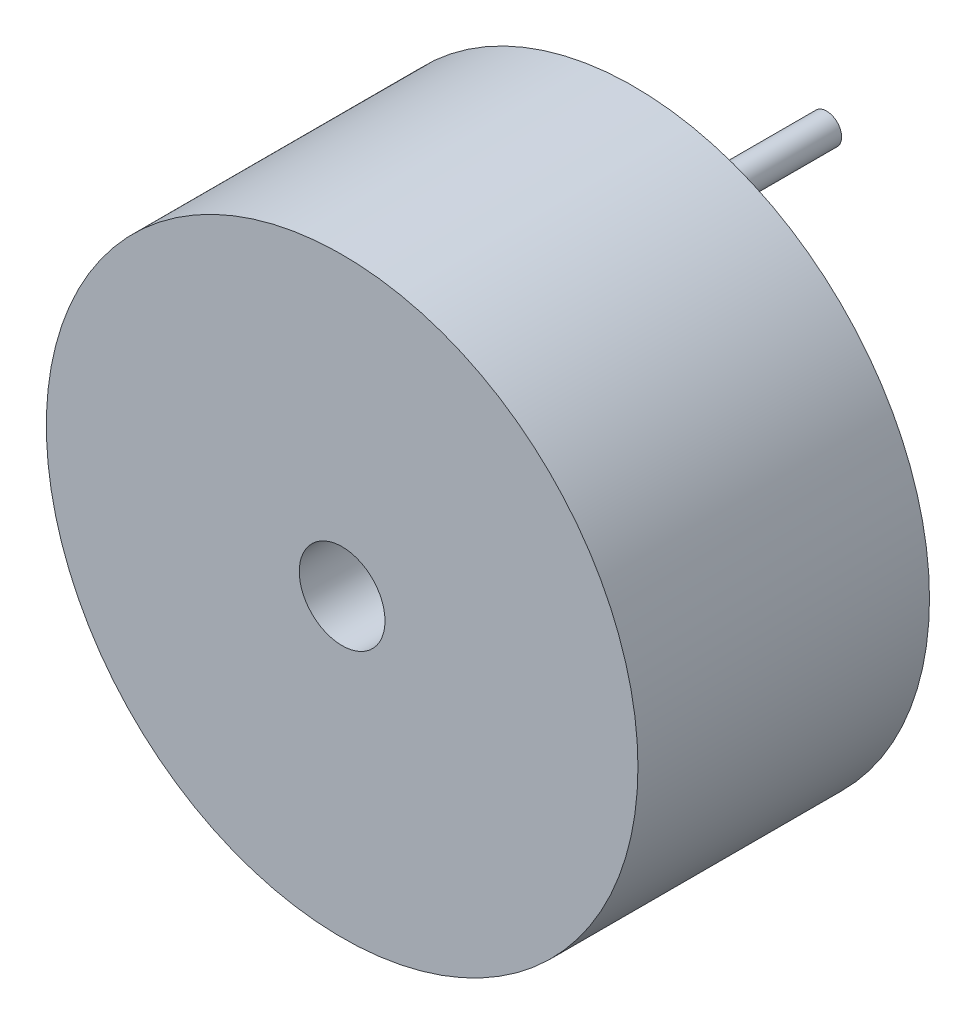
from build123d import *

# Parameters (mm, degrees)
SKETCH1_R           = 6.9
BOSS_EXTRUDE1_DEPTH = 6.8
SKETCH2_R           = 1
CUT_EXTRUDE1_DEPTH  = 2
SKETCH3_R           = 0.35
BOSS_EXTRUDE2_DEPTH = 4.5


with BuildPart() as part:
    # Sketch1 → Boss-Extrude1 (new body)
    with BuildSketch(Plane.XY):
        Circle(SKETCH1_R)
    extrude(amount=BOSS_EXTRUDE1_DEPTH)

    # Sketch2 → Cut-Extrude1 (cut)
    with BuildSketch(Plane.XY.offset(6.8)):
        Circle(SKETCH2_R)
    extrude(amount=-CUT_EXTRUDE1_DEPTH, mode=Mode.SUBTRACT)

    # Sketch3 → Boss-Extrude2 (add)
    with BuildSketch(Plane(origin=(0, 0, 0), x_dir=(-1, 0, 0), z_dir=(0, 0, -1))):
        with Locations(Location((0, 3.8, 0), (0, 0, 180))):
            Circle(SKETCH3_R)
        with Locations(Location((0, -3.8, 0), (0, 0, 180))):
            Circle(SKETCH3_R)
    extrude(amount=BOSS_EXTRUDE2_DEPTH)


solid = part.part
